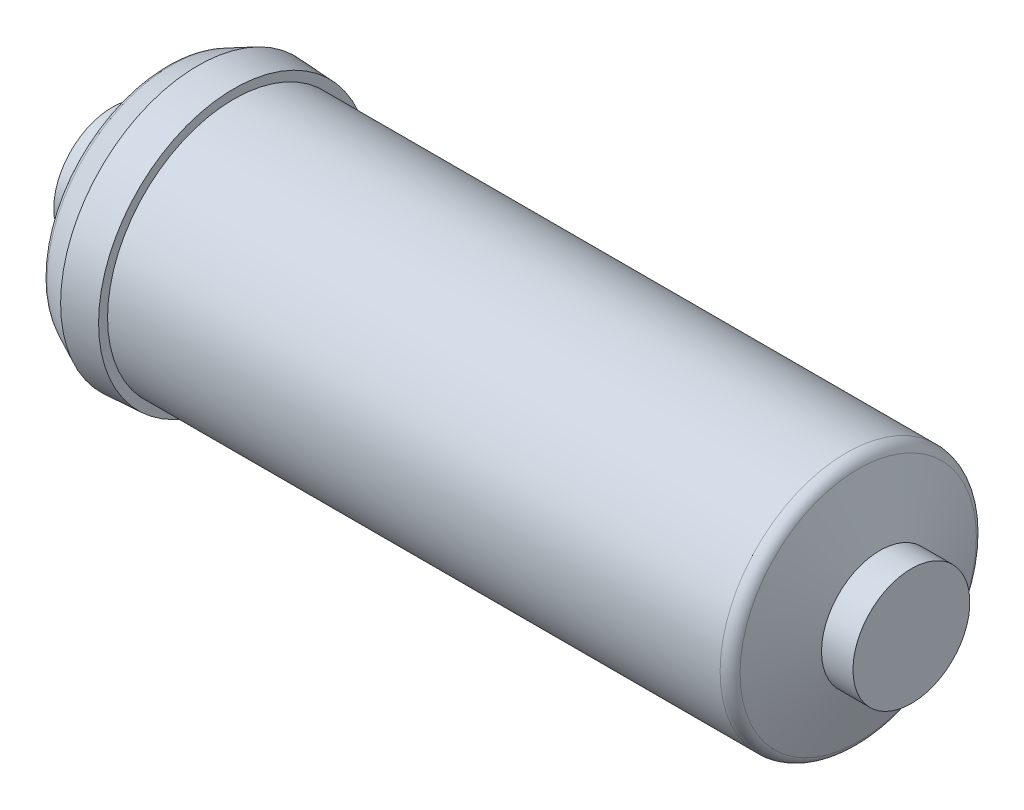
from build123d import *

# Parameters (mm, degrees)
FILLET1_R = 3.175


with BuildPart() as part:
    # Sketch1 → Revolve1 (revolve)
    with BuildSketch(Plane.XY, mode=Mode.PRIVATE) as revolve1_sk:
        Polygon((0, 0), (0, 14.859), (8.001, 14.859), (13.917700128, 31.115), (21.791700128, 34.925), (30.935700128, 34.417), (30.935700128, 32.131), (188.912506114, 32.131), (195.199, 14.859), (203.2, 14.859), (203.2, 0), align=None)
    revolve(revolve1_sk.sketch.rotate(Axis((0, 0, 0), (1, 0, 0)), 90), axis=Axis((0, 0, 0), (1, 0, 0)))

    # Fillet1
    fillet1_edges = [part.edges().sort_by_distance(p)[0] for p in [
        (188.912506114, 0, -32.131),
        (13.917700128, 0, -31.115),
    ]]
    fillet(fillet1_edges, radius=FILLET1_R)


solid = part.part
